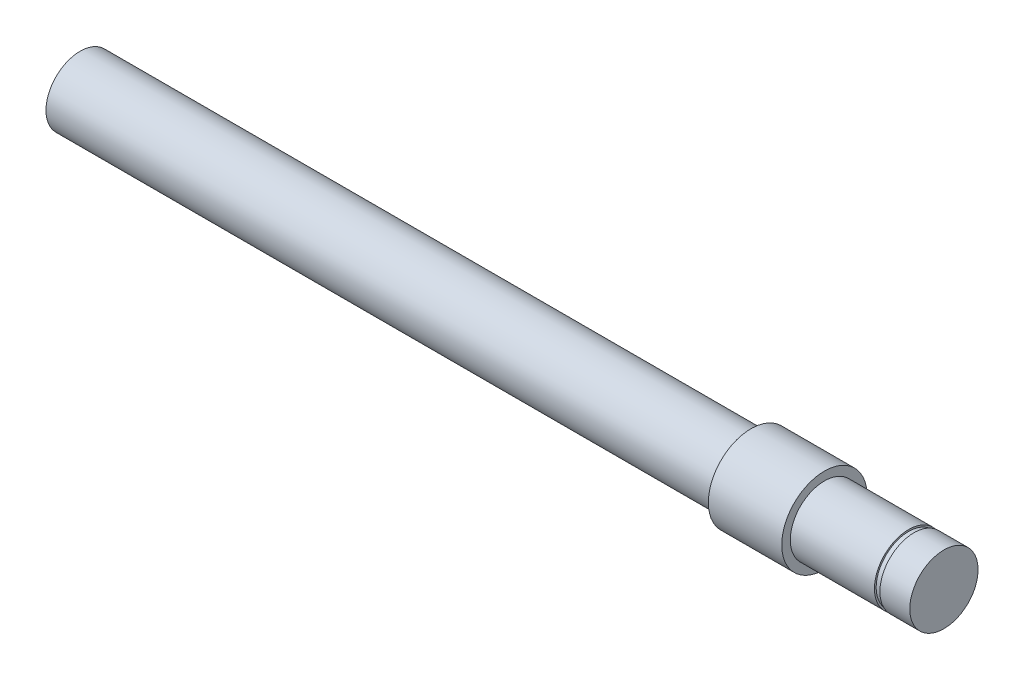
from build123d import *

# Parameters (mm, degrees)
SKETCH1_W = 12
SKETCH1_H = 2


with BuildPart() as part:
    # Sketch1 → Revolve1 (revolve)
    with BuildSketch(Plane.XY, mode=Mode.PRIVATE) as revolve1_sk:
        Polygon((27.3, 2.5), (27.3, 2), (0, 2), (0, 0), (38.6, 0), (38.6, 2), (36.85, 2), (36.85, 1.9), (36.53, 1.9), (36.53, 2), (31.6, 2), (31.6, 2.5), align=None)
        with Locations((-6, 1)):
            Rectangle(SKETCH1_W, SKETCH1_H)
    revolve(revolve1_sk.sketch.rotate(Axis((0, 0, 0), (1, 0, 0)), 90), axis=Axis((0, 0, 0), (1, 0, 0)))


solid = part.part
